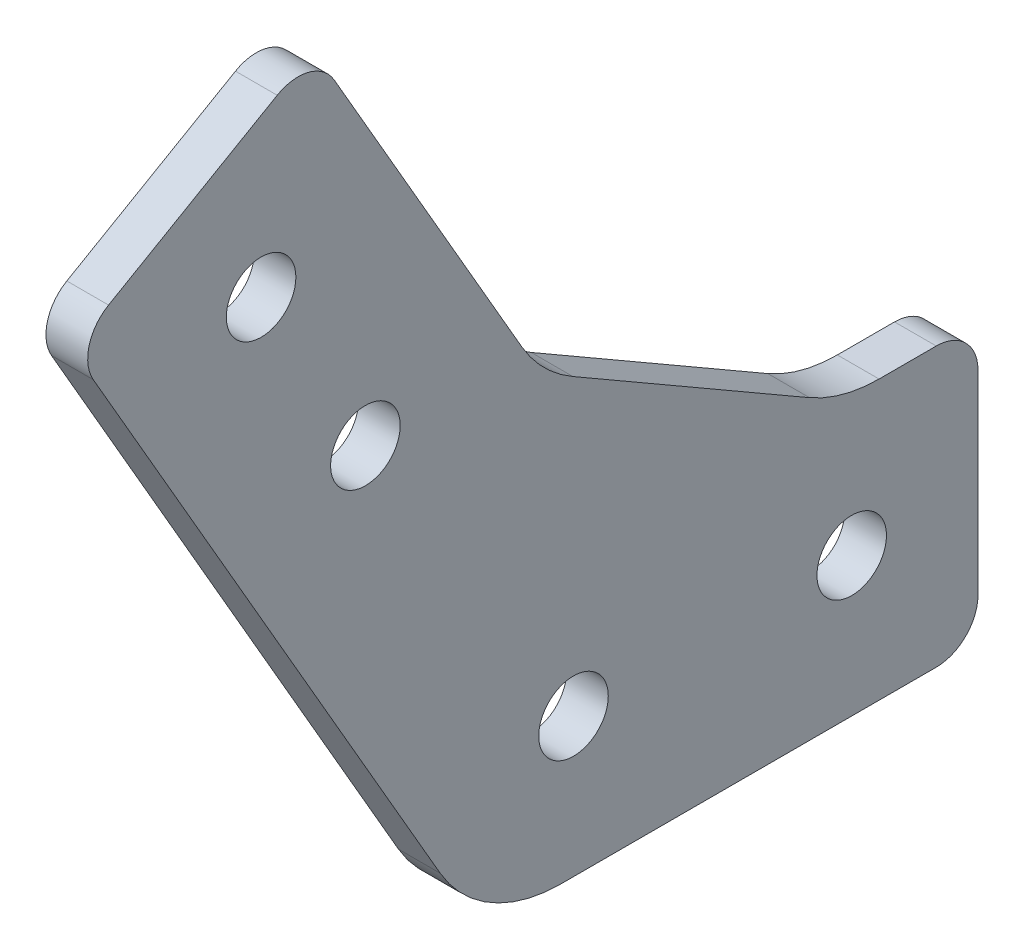
from build123d import *

# Parameters (mm, degrees)
BOSS_EXTRUDE1_DEPTH = 3
SKETCH2_R           = 2.5
CUT_EXTRUDE1_DEPTH  = 62.822600008
FILLET1_R           = 3


with BuildPart() as part:
    # Sketch1 → Boss-Extrude1 (new body)
    with BuildSketch(Plane(origin=(0, 0, 0), x_dir=(0, 0, -1), z_dir=(1, 0, 0))):
        with BuildLine():
            Line((22.886751346, 10), (30, 10))
            Line((30, 10), (30, -10))
            Line((30, -10), (0, -10))
            ThreePointArc((0, -10), (-5, -8.660254038), (-8.660254038, -5))
            Line((-8.660254038, -5), (-35.103629711, 40.801270189))
            Line((-35.103629711, 40.801270189), (-17.783121635, 50.801270189))
            Line((-17.783121635, 50.801270189), (-2.783121635, 24.820508076))
            ThreePointArc((-2.783121635, 24.820508076), (-1.193935409, 22.749440264), (0.877132403, 21.160254038))
            Line((0.877132403, 21.160254038), (17.886751346, 11.339745962))
            ThreePointArc((17.886751346, 11.339745962), (20.298560895, 10.340741737), (22.886751346, 10))
        make_face()
    extrude(amount=BOSS_EXTRUDE1_DEPTH)

    # Sketch2 → Cut-Extrude1 (cut, through all)
    with BuildSketch(Plane(origin=(3, 0, 0), x_dir=(0, 0, -1), z_dir=(1, 0, 0))):
        with Locations((20.92, 0)):
            Circle(SKETCH2_R)
        with Locations((0.92, 0)):
            Circle(SKETCH2_R)
        with Locations((-14.04, 24.32)):
            Circle(SKETCH2_R)
        with Locations((-21.54, 37.31)):
            Circle(SKETCH2_R)
    extrude(amount=-CUT_EXTRUDE1_DEPTH, mode=Mode.SUBTRACT)

    # Fillet1
    fillet1_edges = [part.edges().sort_by_distance(p)[0] for p in [
        (1.5, 50.801270189, 17.783121635),
        (1.5, 10, -30),
        (1.5, -10, -30),
        (1.5, 40.801270189, 35.103629711),
    ]]
    fillet(fillet1_edges, radius=FILLET1_R)


solid = part.part
